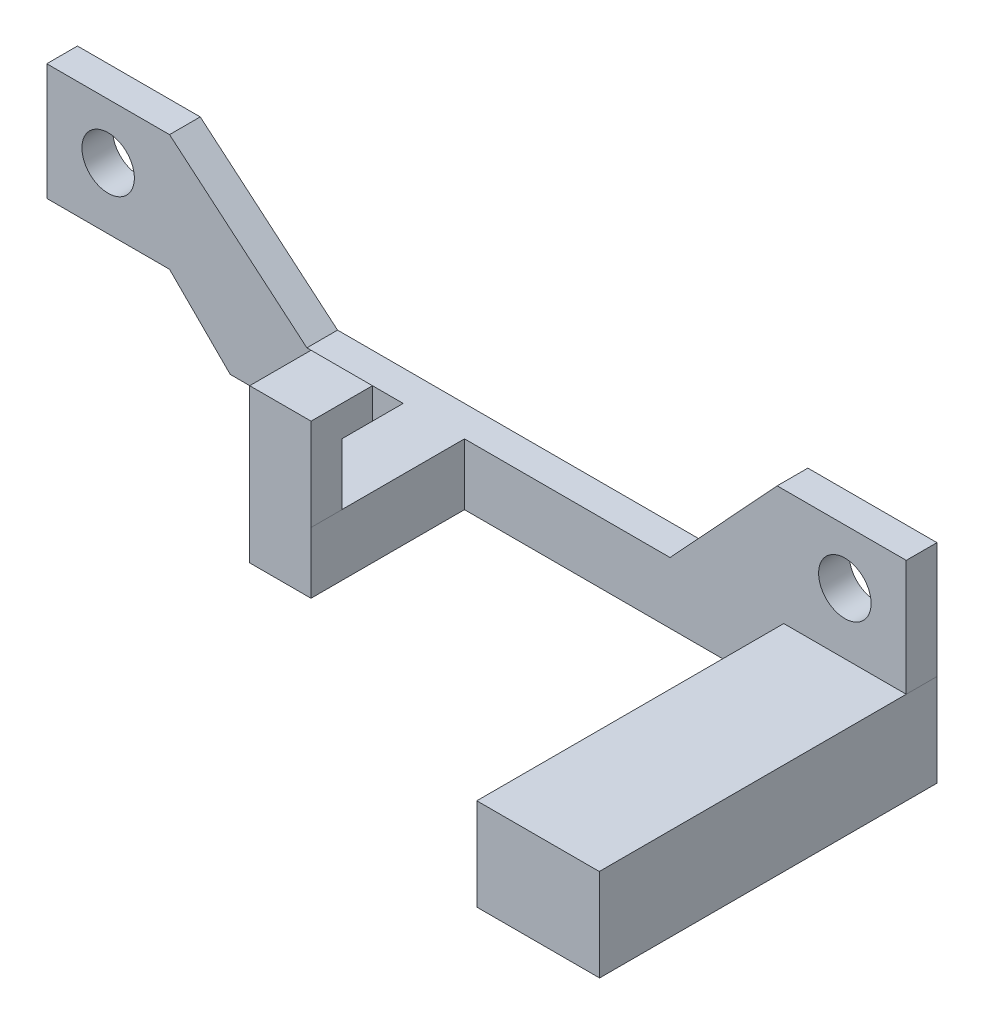
from build123d import *

# Parameters (mm, degrees)
SKETCH1_R                = 2.1717
BOSS_EXTRUDE2_DEPTH      = 2.54
BOSS_EXTRUDE3_DEPTH      = 25.4
BOSS_EXTRUDE3_DEPTH_BACK = 2.54
SKETCH3_W                = 5.074384234
SKETCH3_H                = 5.076844133
BOSS_EXTRUDE4_DEPTH      = 12.7
BOSS_EXTRUDE5_DEPTH      = 5.08


with BuildPart() as part:
    # Sketch1 → Boss-Extrude2 (new body)
    with BuildSketch(Plane.XY):
        Polygon((5.08, -5.08), (-5.08, -5.08), (-5.08, 4.572), (5.08, 4.572), (16.444283816, -5.025270266), (46.498564563, -5.025270266), (55.358360552, 4.543956213), (66.03999997, 4.543956213), (66.03999997, -5.052635133), (55.90534362, -5.052635133), (51.228827675, -10.102114399), (10.102114399, -10.102114399), align=None)
        Circle(SKETCH1_R, mode=Mode.SUBTRACT)
        with Locations((60.96, 0)):
            Circle(SKETCH1_R, mode=Mode.SUBTRACT)
    extrude(amount=BOSS_EXTRUDE2_DEPTH)

    # Sketch2 → Boss-Extrude3 (add, two sides: drawn at the far end of the back side and taken through both)
    with BuildSketch(Plane.XY.offset(2.54).offset(-BOSS_EXTRUDE3_DEPTH_BACK)):
        Polygon((55.90534362, -5.052635133), (55.90534362, -12.672635133), (66.06534362, -12.672635133), (66.03999997, -5.052635133), align=None)
    extrude(amount=BOSS_EXTRUDE3_DEPTH + BOSS_EXTRUDE3_DEPTH_BACK)

    # Sketch3 → Boss-Extrude4 (add)
    with BuildSketch(Plane.XY.offset(2.54)):
        with Locations((26.948840143, -7.563692333)):
            Rectangle(SKETCH3_W, SKETCH3_H)
    extrude(amount=BOSS_EXTRUDE4_DEPTH)

    # Sketch5 → Boss-Extrude5 (add)
    with BuildSketch(Plane.ZY.offset(-24.411648026)):
        Polygon((15.24, -5.025270266), (15.24, 2.594729734), (12.699847587, 2.594729734), (10.159847587, 2.594729734), (10.159847587, 0.054729734), (12.699847587, 0.054729734), (12.699847587, -5.025270266), align=None)
    extrude(amount=-BOSS_EXTRUDE5_DEPTH)


solid = part.part
